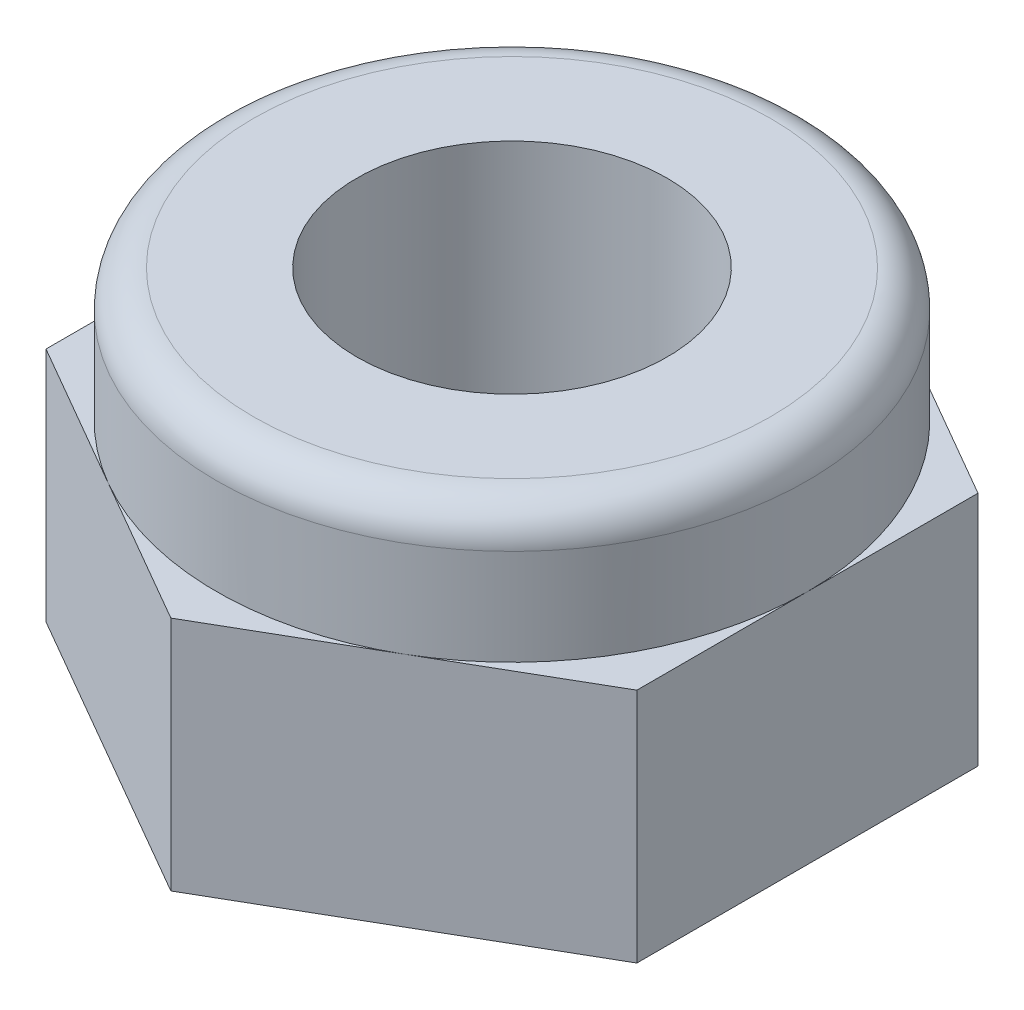
from build123d import *

# Parameters (mm, degrees)
EXTRUDE_1_DEPTH    = 3.2
SKETCH_2_R         = 4
EXTRUDE_2_DEPTH    = 1.8
FILLET_1_R         = 0.5
HOLE_WIZARD_M5_1_D = 4.2


with BuildPart() as part:
    # 草图1 → 凸台-拉伸1 (new body)
    with BuildSketch(Plane(origin=(0, 0, 0), x_dir=(1, 0, 0), z_dir=(0, 1, 0))):
        Polygon((0, 4.618802154), (-4, 2.309401077), (-4, -2.309401077), (0, -4.618802154), (4, -2.309401077), (4, 2.309401077), align=None)
    extrude(amount=EXTRUDE_1_DEPTH)

    # 草图2 → 凸台-拉伸2 (add)
    with BuildSketch(Plane(origin=(0, 3.2, 0), x_dir=(1, 0, 0), z_dir=(0, 1, 0))):
        with Locations(Location((0, 0, 0), (0, 0, 60))):
            Circle(SKETCH_2_R)
    extrude(amount=EXTRUDE_2_DEPTH)

    # 圆角1
    fillet_1_edges = [part.edges().sort_by_distance(p)[0] for p in [
        (-2, 5, 3.464101615),
    ]]
    fillet(fillet_1_edges, radius=FILLET_1_R)

    # M5 螺纹孔1 (through all)
    with Locations(Plane(origin=(0, 5, 0), x_dir=(1, 0, 0), z_dir=(0, 1, 0))):
        with Locations((0, 0)):
            Hole(HOLE_WIZARD_M5_1_D / 2)


solid = part.part
